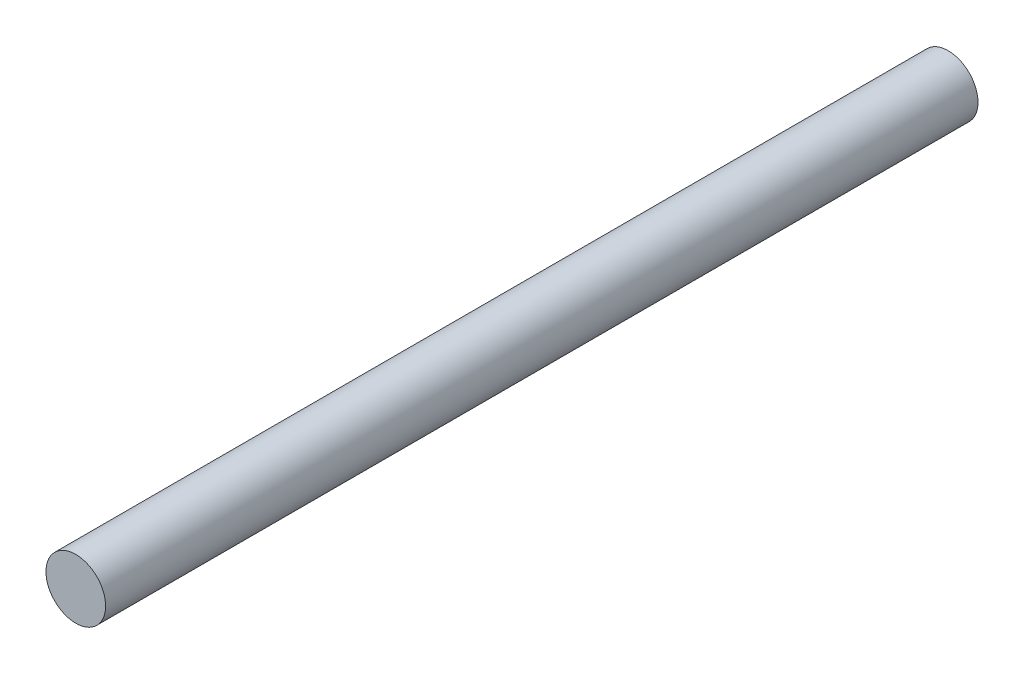
from build123d import *

# Parameters (mm, degrees)
CROQUIS1_R              = 4
SALIENTE_EXTRUIR1_DEPTH = 117


with BuildPart() as part:
    # Croquis1 → Saliente-Extruir1 (new body)
    with BuildSketch(Plane.XY):
        Circle(CROQUIS1_R)
    extrude(amount=SALIENTE_EXTRUIR1_DEPTH)


solid = part.part
